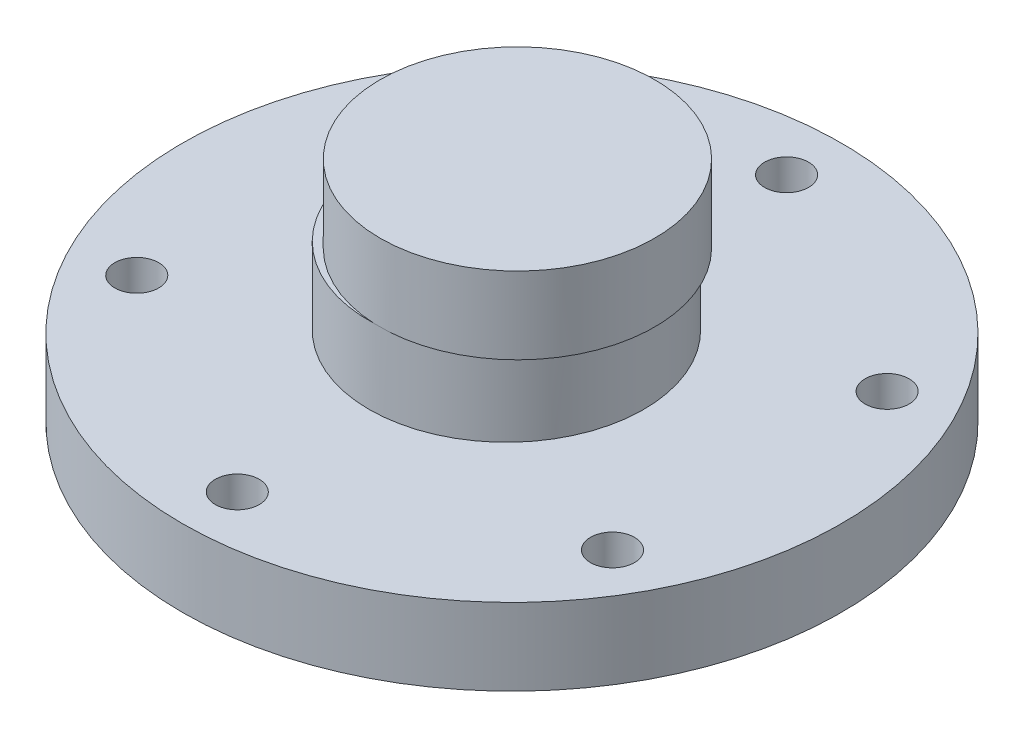
from build123d import *

# Parameters (mm, degrees)
SKETCH1_R           = 30
SKETCH1_R_2         = 2
BOSS_EXTRUDE1_DEPTH = 7
SKETCH2_R           = 12.5
BOSS_EXTRUDE2_DEPTH = 7
SKETCH3_R           = 12.5
BOSS_EXTRUDE3_DEPTH = 7


with BuildPart() as part:
    # Sketch1 → Boss-Extrude1 (new body)
    with BuildSketch(Plane(origin=(0, 0, 0), x_dir=(1, 0, 0), z_dir=(0, 1, 0))):
        with Locations(Location((0, 0, 0), (0, 0, 270))):
            Circle(SKETCH1_R)
        with Locations(Location((0, 25, 0), (0, 0, 270))):
            Circle(SKETCH1_R_2, mode=Mode.SUBTRACT)
        with Locations(Location((21.650635095, 12.5, 0), (0, 0, 270))):
            Circle(SKETCH1_R_2, mode=Mode.SUBTRACT)
        with Locations(Location((21.650635095, -12.5, 0), (0, 0, 270))):
            Circle(SKETCH1_R_2, mode=Mode.SUBTRACT)
        with Locations(Location((0, -25, 0), (0, 0, 270))):
            Circle(SKETCH1_R_2, mode=Mode.SUBTRACT)
        with Locations(Location((-21.650635095, -12.5, 0), (0, 0, 270))):
            Circle(SKETCH1_R_2, mode=Mode.SUBTRACT)
        with Locations(Location((-21.650635095, 12.5, 0), (0, 0, 270))):
            Circle(SKETCH1_R_2, mode=Mode.SUBTRACT)
    extrude(amount=BOSS_EXTRUDE1_DEPTH)

    # Sketch2 → Boss-Extrude2 (add)
    with BuildSketch(Plane(origin=(0, 7, 0), x_dir=(1, 0, 0), z_dir=(0, 1, 0))):
        with Locations(Location((-0.5, 0, 0), (0, 0, 270))):
            Circle(SKETCH2_R)
    extrude(amount=BOSS_EXTRUDE2_DEPTH)

    # Sketch3 → Boss-Extrude3 (add)
    with BuildSketch(Plane(origin=(0, 14, 0), x_dir=(1, 0, 0), z_dir=(0, 1, 0))):
        with Locations(Location((0.5, 0, 0), (0, 0, 92.292442776))):
            Circle(SKETCH3_R)
    extrude(amount=BOSS_EXTRUDE3_DEPTH)


solid = part.part
